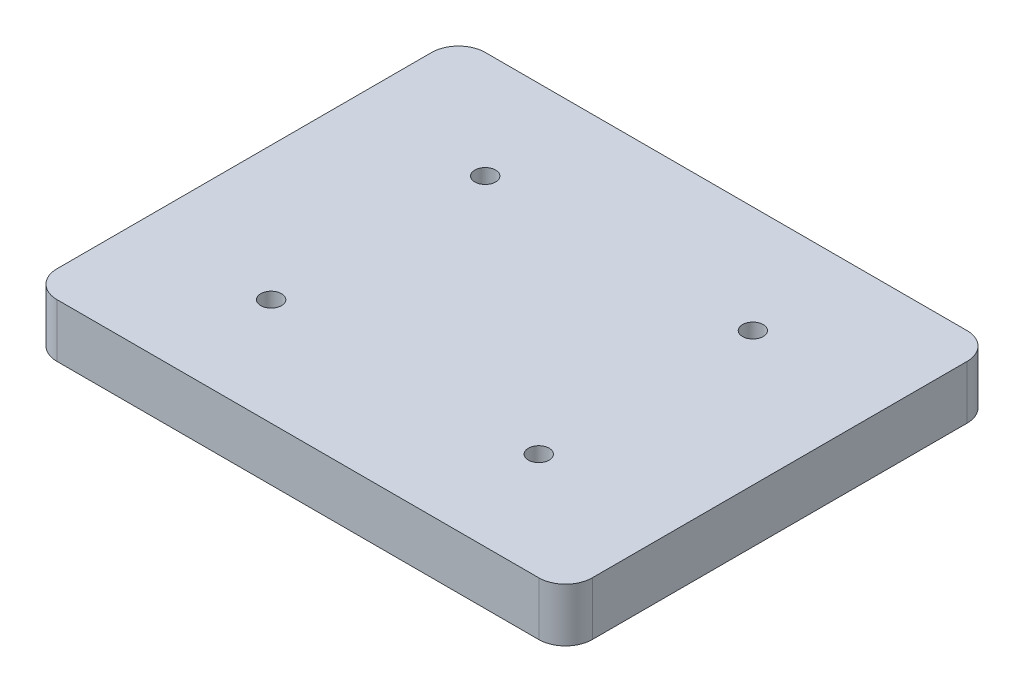
from build123d import *

# Parameters (mm, degrees)
SKETCH1_W               = 127
SKETCH1_H               = 101.6
BOSS_EXTRUDE1_DEPTH     = 12.7
CUT_EXTRUDE1_DEPTH      = 164.134453749
CUT_EXTRUDE1_DEPTH_BACK = 164.134453749
SKETCH2_R               = 2.4638
FILLET1_R               = 6.35


with BuildPart() as part:
    # Sketch1 → Boss-Extrude1 (new body)
    with BuildSketch(Plane(origin=(0, 0, 0), x_dir=(1, 0, 0), z_dir=(0, 1, 0))):
        with Locations((63.5, 50.8)):
            Rectangle(SKETCH1_W, SKETCH1_H)
    extrude(amount=BOSS_EXTRUDE1_DEPTH)

    # Sketch2 → Cut-Extrude1 (cut, two sides: drawn at the far end of the back side and taken through both)
    with BuildSketch(Plane(origin=(0, 12.7, 0), x_dir=(1, 0, 0), z_dir=(0, 1, 0)).offset(-CUT_EXTRUDE1_DEPTH_BACK)):
        with Locations(Location((31.75, 76.2, 0), (0, 0, 270))):
            Circle(SKETCH2_R)
        with Locations(Location((95.25, 76.2, 0), (0, 0, 270))):
            Circle(SKETCH2_R)
        with Locations(Location((95.25, 25.4, 0), (0, 0, 270))):
            Circle(SKETCH2_R)
        with Locations(Location((31.75, 25.4, 0), (0, 0, 270))):
            Circle(SKETCH2_R)
    extrude(amount=CUT_EXTRUDE1_DEPTH + CUT_EXTRUDE1_DEPTH_BACK, mode=Mode.SUBTRACT)

    # Fillet1
    fillet1_edges = [part.edges().sort_by_distance(p)[0] for p in [
        (0, 6.35, -101.6),
        (127, 6.35, -101.6),
        (127, 6.35, 0),
        (0, 6.35, 0),
    ]]
    fillet(fillet1_edges, radius=FILLET1_R)


solid = part.part
